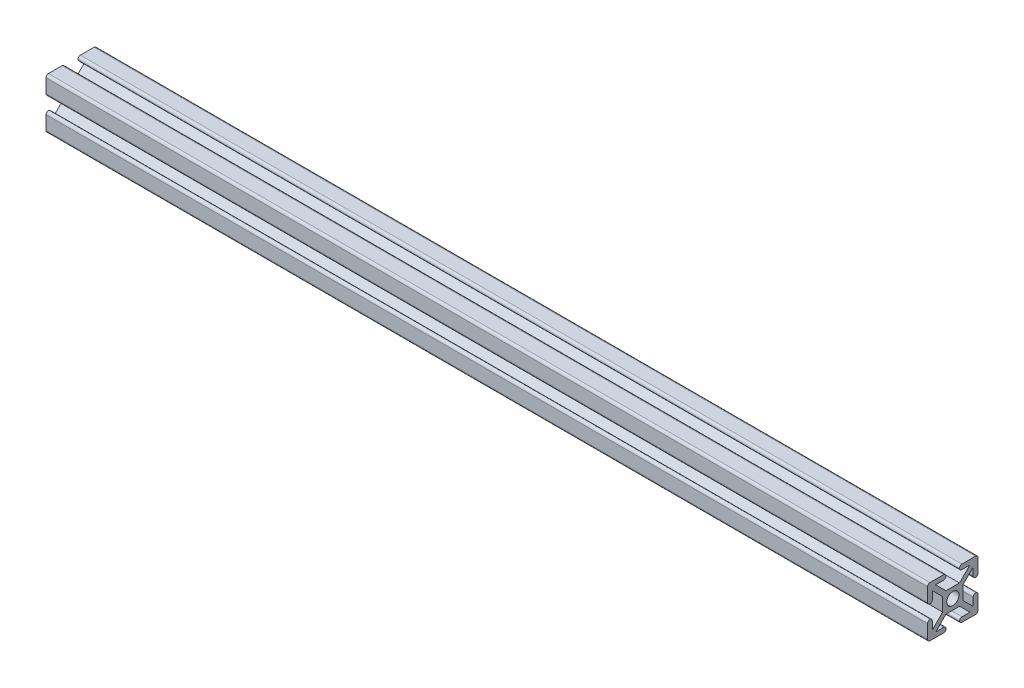
from build123d import *

# Parameters (mm, degrees)
CROQUIS1_R              = 3.645
SALIENTE_EXTRUIR1_DEPTH = 523.8
CROQUIS2_R              = 4
CORTAR_EXTRUIR1_DEPTH   = 523.8


with BuildPart() as part:
    # Croquis1 → Saliente-Extruir1 (new body)
    with BuildSketch(Plane(origin=(0, 0, 0), x_dir=(0, 0, -1), z_dir=(1, 0, 0))):
        with BuildLine():
            Line((3.685249022, 10.257804838), (8.410249022, 10.257804838))
            Line((8.410249022, 10.257804838), (2.260249022, 16.407804838))
            Line((2.260249022, 16.407804838), (-5.739750978, 16.407804838))
            Line((-5.739750978, 16.407804838), (-11.889750978, 10.257804838))
            Line((-11.889750978, 10.257804838), (-7.164750978, 10.257804838))
            ThreePointArc((-7.164750978, 10.257804838), (-5.739750978, 8.832804838), (-7.164750978, 7.407804838))
            Line((-7.164750978, 7.407804838), (-15.341186751, 7.434240611))
            ThreePointArc((-15.341186751, 7.434240611), (-16.330121, 7.843870589), (-16.739750978, 8.832804838))
            Line((-16.739750978, 8.832804838), (-16.739750978, 16.982804838))
            ThreePointArc((-16.739750978, 16.982804838), (-15.341186751, 18.381369066), (-13.942622523, 16.982804838))
            Line((-13.942622523, 16.982804838), (-13.942622523, 12.257804838))
            Line((-13.942622523, 12.257804838), (-7.792622523, 18.407804838))
            Line((-7.792622523, 18.407804838), (-7.792622523, 26.407804838))
            Line((-7.792622523, 26.407804838), (-13.942622523, 32.557804838))
            Line((-13.942622523, 32.557804838), (-13.942622523, 27.832804838))
            ThreePointArc((-13.942622523, 27.832804838), (-15.367622523, 26.407804838), (-16.792622523, 27.832804838))
            Line((-16.792622523, 27.832804838), (-16.792622523, 35.982758248))
            ThreePointArc((-16.792622523, 35.982758248), (-16.375249687, 36.990385411), (-15.367622523, 37.407758248))
            Line((-15.367622523, 37.407758248), (-7.217622523, 37.407758248))
            ThreePointArc((-7.217622523, 37.407758248), (-5.792622523, 35.982758248), (-7.217622523, 34.557758248))
            Line((-7.217622523, 34.557758248), (-11.942622523, 34.557758248))
            Line((-11.942622523, 34.557758248), (-5.792622523, 28.407758248))
            Line((-5.792622523, 28.407758248), (2.207377477, 28.407758248))
            Line((2.207377477, 28.407758248), (8.357377477, 34.557758248))
            Line((8.357377477, 34.557758248), (3.632377477, 34.557758248))
            ThreePointArc((3.632377477, 34.557758248), (2.207377477, 35.982758248), (3.632377477, 37.407758248))
            Line((3.632377477, 37.407758248), (11.782377477, 37.407758248))
            ThreePointArc((11.782377477, 37.407758248), (12.79000464, 36.990385411), (13.207377477, 35.982758248))
            Line((13.207377477, 35.982758248), (13.207377477, 27.936501934))
            ThreePointArc((13.207377477, 27.936501934), (11.782377477, 26.511501934), (10.357377477, 27.936501934))
            Line((10.357377477, 27.936501934), (10.357377477, 32.557758248))
            Line((10.357377477, 32.557758248), (4.207377477, 26.407758248))
            Line((4.207377477, 26.407758248), (4.207377477, 18.407758248))
            Line((4.207377477, 18.407758248), (10.357377477, 12.257758248))
            Line((10.357377477, 12.257758248), (10.357377477, 17.086501934))
            ThreePointArc((10.357377477, 17.086501934), (11.782377477, 18.511501934), (13.207377477, 17.086501934))
            Line((13.207377477, 17.086501934), (13.207377477, 8.832804838))
            ThreePointArc((13.207377477, 8.832804838), (12.79000464, 7.825177675), (11.782377477, 7.407804838))
            Line((11.782377477, 7.407804838), (3.685249022, 7.407804838))
            ThreePointArc((3.685249022, 7.407804838), (2.260249022, 8.832804838), (3.685249022, 10.257804838))
        make_face()
        with Locations((-1.739750978, 22.407804838)):
            Circle(CROQUIS1_R, mode=Mode.SUBTRACT)
    extrude(amount=SALIENTE_EXTRUIR1_DEPTH)

    # Croquis2 → Cortar-Extruir1 (cut)
    with BuildSketch(Plane.XY.offset(7.792622523)):
        with Locations(Location((18.84, 22.407804838, 0), (0, 0, 89.723462138))):
            Circle(CROQUIS2_R)
        with Locations(Location((75.14, 22.407804838, 0), (0, 0, 89.723462138))):
            Circle(CROQUIS2_R)
        with Locations(Location((448.84, 22.407804838, 0), (0, 0, 89.723462138))):
            Circle(CROQUIS2_R)
        with Locations(Location((505.14, 22.407804838, 0), (0, 0, 89.723462138))):
            Circle(CROQUIS2_R)
    extrude(amount=-CORTAR_EXTRUIR1_DEPTH, mode=Mode.SUBTRACT)


solid = part.part
